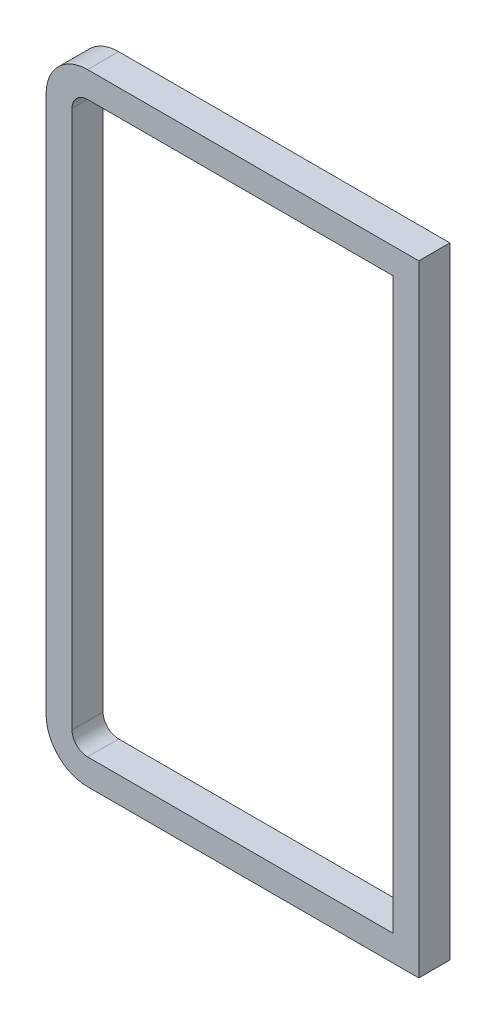
from build123d import *

# Parameters (mm, degrees)
BOSS_EXTRUDE1_DEPTH = 76.2
CUT_EXTRUDE2_DEPTH  = 1779.906911561


with BuildPart() as part:
    # Sketch1 → Boss-Extrude1 (new body)
    with BuildSketch(Plane.XY):
        with BuildLine():
            Line((101.6, 0), (914.4, 0))
            Line((914.4, 0), (914.4, 1524))
            Line((914.4, 1524), (101.6, 1524))
            ThreePointArc((101.6, 1524), (29.757951031, 1494.242048969), (0, 1422.4))
            Line((0, 1422.4), (0, 101.6))
            ThreePointArc((0, 101.6), (29.757951031, 29.757951031), (101.6, 0))
        make_face()
    extrude(amount=BOSS_EXTRUDE1_DEPTH)

    # Sketch2 → Cut-Extrude2 (cut, through all)
    with BuildSketch(Plane.XY.offset(76.2)):
        with BuildLine():
            Line((63.5, 1422.4), (63.5, 101.6))
            ThreePointArc((63.5, 101.6), (74.659231637, 74.659231637), (101.6, 63.5))
            Line((101.6, 63.5), (850.9, 63.5))
            Line((850.9, 63.5), (850.9, 1460.5))
            Line((850.9, 1460.5), (101.6, 1460.5))
            ThreePointArc((101.6, 1460.5), (74.659231637, 1449.340768363), (63.5, 1422.4))
        make_face()
    extrude(amount=-CUT_EXTRUDE2_DEPTH, mode=Mode.SUBTRACT)


solid = part.part
